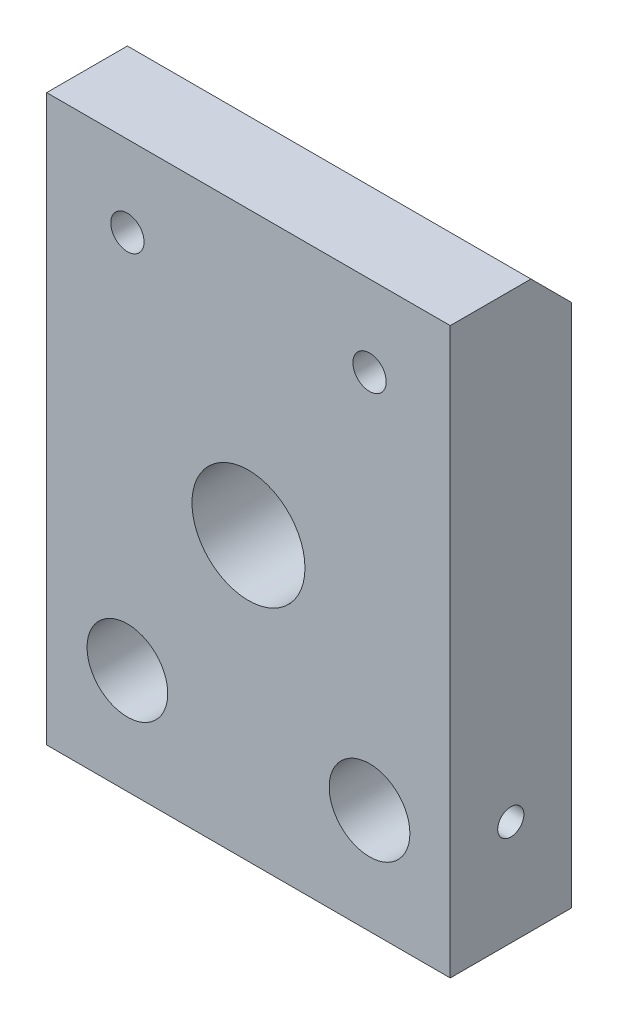
from build123d import *

# Parameters (mm, degrees)
ESQUISSE1_W             = 50
ESQUISSE1_H             = 70
ESQUISSE1_R             = 5
ESQUISSE1_R_2           = 7
ESQUISSE1_R_3           = 2.065
BASE_EXTRUSION_DEPTH    = 15
CHANFREIN3_SIZE         = 5
ENL_V_MAT_EXTRU_1_REACH = 89.321
ESQUISSE10_R            = 1.62


with BuildPart() as part:
    # Esquisse1 → Base-Extrusion (new body)
    with BuildSketch(Plane.XY):
        with Locations((0, 35)):
            Rectangle(ESQUISSE1_W, ESQUISSE1_H)
        with Locations((15, 13)):
            Circle(ESQUISSE1_R, mode=Mode.SUBTRACT)
        with Locations(Location((-15, 13, 0), (0, 0, 180))):
            Circle(ESQUISSE1_R, mode=Mode.SUBTRACT)
        with Locations((0, 35)):
            Circle(ESQUISSE1_R_2, mode=Mode.SUBTRACT)
        with Locations((-15, 60)):
            Circle(ESQUISSE1_R_3, mode=Mode.SUBTRACT)
        with Locations(Location((15, 60, 0), (0, 0, 180))):
            Circle(ESQUISSE1_R_3, mode=Mode.SUBTRACT)
    extrude(amount=BASE_EXTRUSION_DEPTH)

    # Chanfrein3
    chanfrein3_edges = [part.edges().sort_by_distance(p)[0] for p in [
        (0, 70, 0),
    ]]
    chamfer(chanfrein3_edges, length=CHANFREIN3_SIZE)

    # Esquisse10 → Enlèv. mat.-Extru.1 (cut, up to next)
    with BuildSketch(Plane(origin=(25, 0, 0), x_dir=(0, 0, -1), z_dir=(1, 0, 0)), mode=Mode.PRIVATE) as enl_v_mat_extru_1_sk1:
        with Locations((-7.5, 13)):
            Circle(ESQUISSE10_R)
    enl_v_mat_extru_1_tool1 = extrude(enl_v_mat_extru_1_sk1.sketch, amount=-ENL_V_MAT_EXTRU_1_REACH, mode=Mode.PRIVATE) & part.part
    enl_v_mat_extru_1 = enl_v_mat_extru_1_tool1.solids().sort_by_distance((25, 13, 7.5))[0]
    add(enl_v_mat_extru_1, mode=Mode.SUBTRACT)

    # Symétrie1: Enlèv. mat.-Extru.1 across plane
    add(enl_v_mat_extru_1.mirror(Plane(origin=(0, 0, 0), x_dir=(0, 0, 1), z_dir=(1, 0, 0))), mode=Mode.SUBTRACT)


solid = part.part
